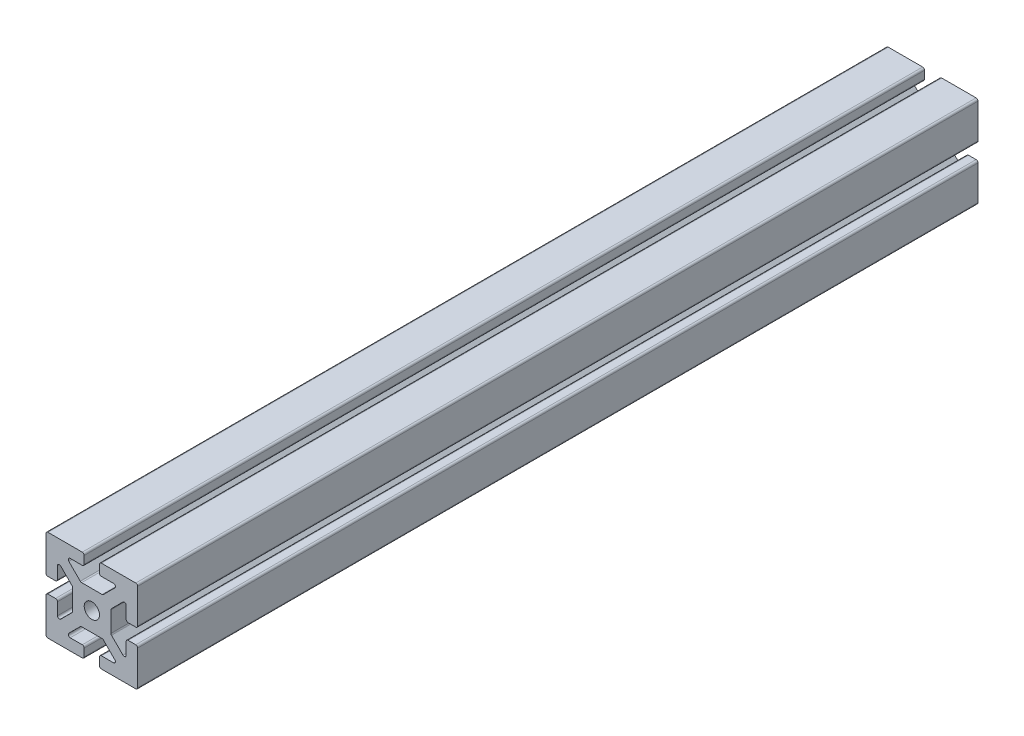
from build123d import *

# Parameters (mm, degrees)
SKETCH2_R           = 1
BOSS_EXTRUDE1_DEPTH = 55


with BuildPart() as part:
    # Sketch2 → Boss-Extrude1 (new, symmetric)
    with BuildSketch(Plane.XY):
        with BuildLine():
            Line((0, 2.5), (1.335786438, 2.5))
            ThreePointArc((1.335786438, 2.5), (1.431457296, 2.519030117), (1.512563133, 2.573223305))
            Line((1.512563133, 2.573223305), (3.012563133, 4.073223305))
            ThreePointArc((3.012563133, 4.073223305), (3.066756321, 4.345670858), (2.835786438, 4.5))
            Line((2.835786438, 4.5), (1.25, 4.5))
            ThreePointArc((1.25, 4.5), (1.073223305, 4.573223305), (1, 4.75))
            Line((1, 4.75), (1, 5.75))
            ThreePointArc((1, 5.75), (1.073223305, 5.926776695), (1.25, 6))
            Line((1.25, 6), (5.75, 6))
            ThreePointArc((5.75, 6), (5.926776695, 5.926776695), (6, 5.75))
            Line((6, 5.75), (6, 1.25))
            ThreePointArc((6, 1.25), (5.926776695, 1.073223305), (5.75, 1))
            Line((5.75, 1), (4.75, 1))
            ThreePointArc((4.75, 1), (4.573223305, 1.073223305), (4.5, 1.25))
            Line((4.5, 1.25), (4.5, 2.835786438))
            ThreePointArc((4.5, 2.835786438), (4.345670858, 3.066756321), (4.073223305, 3.012563133))
            Line((4.073223305, 3.012563133), (2.573223305, 1.512563133))
            ThreePointArc((2.573223305, 1.512563133), (2.519030117, 1.431457296), (2.5, 1.335786438))
            Line((2.5, 1.335786438), (2.5, 0))
            Line((2.5, 0), (2.5, -1.335786438))
            ThreePointArc((2.5, -1.335786438), (2.519030117, -1.431457296), (2.573223305, -1.512563133))
            Line((2.573223305, -1.512563133), (4.073223305, -3.012563133))
            ThreePointArc((4.073223305, -3.012563133), (4.345670858, -3.066756321), (4.5, -2.835786438))
            Line((4.5, -2.835786438), (4.5, -1.25))
            ThreePointArc((4.5, -1.25), (4.573223305, -1.073223305), (4.75, -1))
            Line((4.75, -1), (5.75, -1))
            ThreePointArc((5.75, -1), (5.926776695, -1.073223305), (6, -1.25))
            Line((6, -1.25), (6, -5.75))
            ThreePointArc((6, -5.75), (5.926776695, -5.926776695), (5.75, -6))
            Line((5.75, -6), (1.25, -6))
            ThreePointArc((1.25, -6), (1.073223305, -5.926776695), (1, -5.75))
            Line((1, -5.75), (1, -4.75))
            ThreePointArc((1, -4.75), (1.073223305, -4.573223305), (1.25, -4.5))
            Line((1.25, -4.5), (2.835786438, -4.5))
            ThreePointArc((2.835786438, -4.5), (3.066756321, -4.345670858), (3.012563133, -4.073223305))
            Line((3.012563133, -4.073223305), (1.512563133, -2.573223305))
            ThreePointArc((1.512563133, -2.573223305), (1.431457296, -2.519030117), (1.335786438, -2.5))
            Line((1.335786438, -2.5), (0, -2.5))
            Line((0, -2.5), (-1.335786438, -2.5))
            ThreePointArc((-1.335786438, -2.5), (-1.431457296, -2.519030117), (-1.512563133, -2.573223305))
            Line((-1.512563133, -2.573223305), (-3.012563133, -4.073223305))
            ThreePointArc((-3.012563133, -4.073223305), (-3.066756321, -4.345670858), (-2.835786438, -4.5))
            Line((-2.835786438, -4.5), (-1.25, -4.5))
            ThreePointArc((-1.25, -4.5), (-1.073223305, -4.573223305), (-1, -4.75))
            Line((-1, -4.75), (-1, -5.75))
            ThreePointArc((-1, -5.75), (-1.073223305, -5.926776695), (-1.25, -6))
            Line((-1.25, -6), (-5.75, -6))
            ThreePointArc((-5.75, -6), (-5.926776695, -5.926776695), (-6, -5.75))
            Line((-6, -5.75), (-6, -1.25))
            ThreePointArc((-6, -1.25), (-5.926776695, -1.073223305), (-5.75, -1))
            Line((-5.75, -1), (-4.75, -1))
            ThreePointArc((-4.75, -1), (-4.573223305, -1.073223305), (-4.5, -1.25))
            Line((-4.5, -1.25), (-4.5, -2.835786438))
            ThreePointArc((-4.5, -2.835786438), (-4.345670858, -3.066756321), (-4.073223305, -3.012563133))
            Line((-4.073223305, -3.012563133), (-2.573223305, -1.512563133))
            ThreePointArc((-2.573223305, -1.512563133), (-2.519030117, -1.431457296), (-2.5, -1.335786438))
            Line((-2.5, -1.335786438), (-2.5, 0))
            Line((-2.5, 0), (-2.5, 1.335786438))
            ThreePointArc((-2.5, 1.335786438), (-2.519030117, 1.431457296), (-2.573223305, 1.512563133))
            Line((-2.573223305, 1.512563133), (-4.073223305, 3.012563133))
            ThreePointArc((-4.073223305, 3.012563133), (-4.345670858, 3.066756321), (-4.5, 2.835786438))
            Line((-4.5, 2.835786438), (-4.5, 1.25))
            ThreePointArc((-4.5, 1.25), (-4.573223305, 1.073223305), (-4.75, 1))
            Line((-4.75, 1), (-5.75, 1))
            ThreePointArc((-5.75, 1), (-5.926776695, 1.073223305), (-6, 1.25))
            Line((-6, 1.25), (-6, 5.75))
            ThreePointArc((-6, 5.75), (-5.926776695, 5.926776695), (-5.75, 6))
            Line((-5.75, 6), (-1.25, 6))
            ThreePointArc((-1.25, 6), (-1.073223305, 5.926776695), (-1, 5.75))
            Line((-1, 5.75), (-1, 4.75))
            ThreePointArc((-1, 4.75), (-1.073223305, 4.573223305), (-1.25, 4.5))
            Line((-1.25, 4.5), (-2.835786438, 4.5))
            ThreePointArc((-2.835786438, 4.5), (-3.066756321, 4.345670858), (-3.012563133, 4.073223305))
            Line((-3.012563133, 4.073223305), (-1.512563133, 2.573223305))
            ThreePointArc((-1.512563133, 2.573223305), (-1.431457296, 2.519030117), (-1.335786438, 2.5))
            Line((-1.335786438, 2.5), (0, 2.5))
        make_face()
        Circle(SKETCH2_R, mode=Mode.SUBTRACT)
    extrude(amount=BOSS_EXTRUDE1_DEPTH, both=True)


solid = part.part
